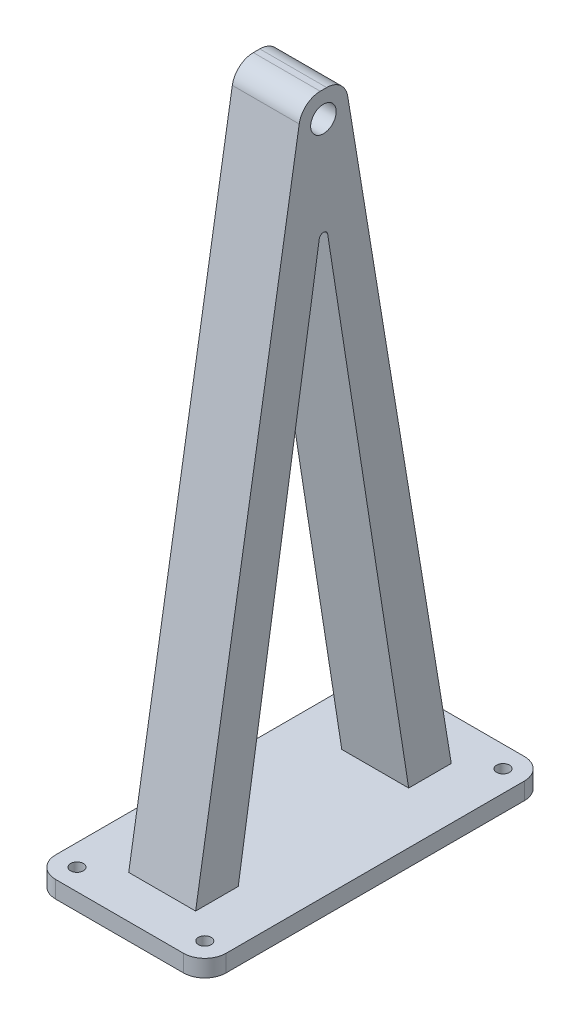
from build123d import *

# Parameters (mm, degrees)
SKETCH1_W           = 40
SKETCH1_H           = 80
SKETCH1_R           = 1.54
SKETCH1_R_2         = 1.5
BOSS_EXTRUDE1_DEPTH = 4
FILLET1_R           = 5
SKETCH2_W           = 15.7
SKETCH2_H           = 60
BOSS_EXTRUDE2_DEPTH = 152
SKETCH3_R           = 3
CUT_EXTRUDE1_DEPTH  = 160
CUT_EXTRUDE2_DEPTH  = 160
FILLET2_R           = 5
CUT_EXTRUDE3_DEPTH  = 160
FILLET3_R           = 1


with BuildPart() as part:
    # Sketch1 → Boss-Extrude1 (new body)
    with BuildSketch(Plane(origin=(0, 0, 0), x_dir=(1, 0, 0), z_dir=(0, 1, 0))):
        with Locations((20, 40)):
            Rectangle(SKETCH1_W, SKETCH1_H)
        with Locations(Location((5, 75, 0), (0, 0, 270))):
            Circle(SKETCH1_R, mode=Mode.SUBTRACT)
        with Locations(Location((35, 75, 0), (0, 0, 270))):
            Circle(SKETCH1_R_2, mode=Mode.SUBTRACT)
        with Locations(Location((5, 5, 0), (0, 0, 270))):
            Circle(SKETCH1_R_2, mode=Mode.SUBTRACT)
        with Locations(Location((35, 5, 0), (0, 0, 270))):
            Circle(SKETCH1_R_2, mode=Mode.SUBTRACT)
    extrude(amount=BOSS_EXTRUDE1_DEPTH)

    # Fillet1
    fillet1_edges = [part.edges().sort_by_distance(p)[0] for p in [
        (0, 2, -80),
        (40, 2, -80),
        (40, 2, 0),
        (0, 2, 0),
    ]]
    fillet(fillet1_edges, radius=FILLET1_R)

    # Sketch2 → Boss-Extrude2 (add)
    with BuildSketch(Plane(origin=(0, 4, 0), x_dir=(1, 0, 0), z_dir=(0, 1, 0))):
        with Locations((20, 40)):
            Rectangle(SKETCH2_W, SKETCH2_H)
    extrude(amount=BOSS_EXTRUDE2_DEPTH)

    # Sketch3 → Cut-Extrude1 (cut)
    with BuildSketch(Plane(origin=(40, 0, 0), x_dir=(0, 0, -1), z_dir=(1, 0, 0))):
        with Locations((40, 150)):
            Circle(SKETCH3_R)
    extrude(amount=-CUT_EXTRUDE1_DEPTH, mode=Mode.SUBTRACT)

    # Sketch4 → Cut-Extrude2 (cut)
    with BuildSketch(Plane(origin=(40, 0, 0), x_dir=(0, 0, -1), z_dir=(1, 0, 0))):
        Polygon((35, 156), (10, 4), (10, 156), align=None)
        Polygon((45, 156), (70, 4), (70, 156), align=None)
    extrude(amount=-CUT_EXTRUDE2_DEPTH, mode=Mode.SUBTRACT)

    # Fillet2
    fillet2_edges = [part.edges().sort_by_distance(p)[0] for p in [
        (20, 156, -45),
        (20, 156, -35),
    ]]
    fillet(fillet2_edges, radius=FILLET2_R)

    # Sketch5 → Cut-Extrude3 (cut)
    with BuildSketch(Plane(origin=(27.85, 0, 0), x_dir=(0, 0, -1), z_dir=(1, 0, 0))):
        Polygon((20, 4), (40, 132.452325787), (60, 4), align=None)
    extrude(amount=-CUT_EXTRUDE3_DEPTH, mode=Mode.SUBTRACT)

    # Fillet3
    fillet3_edges = [part.edges().sort_by_distance(p)[0] for p in [
        (20, 132.452325787, -40),
    ]]
    fillet(fillet3_edges, radius=FILLET3_R)


solid = part.part
